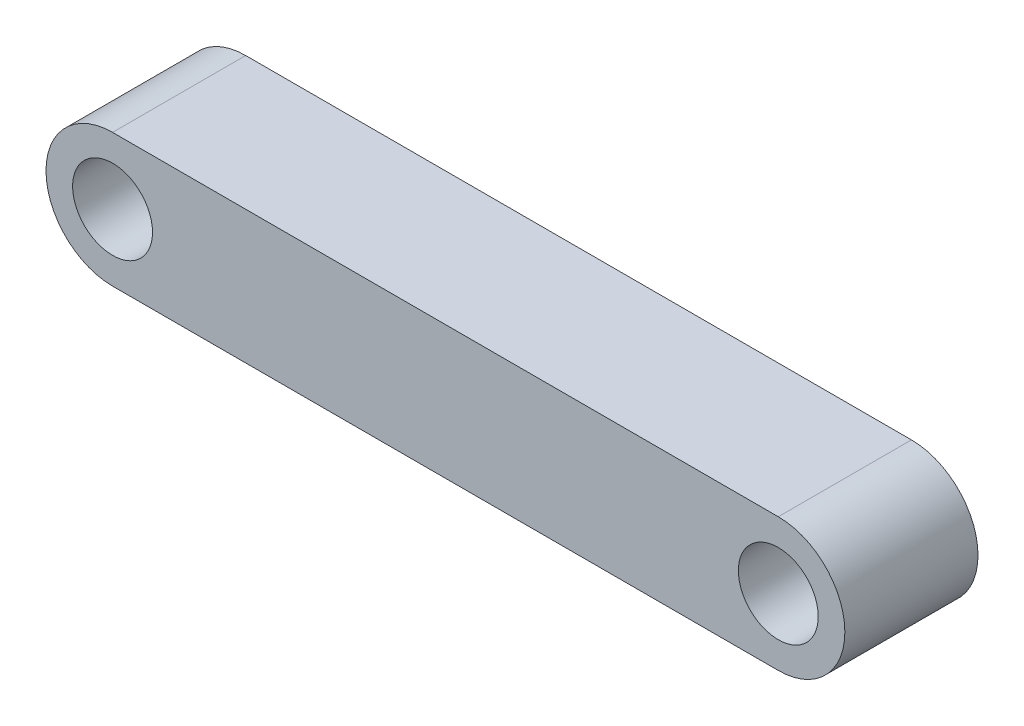
from build123d import *

# Parameters (mm, degrees)
BOSS_EXTRUDE1_DEPTH = 20
SKETCH2_R           = 6
CUT_EXTRUDE1_DEPTH  = 65.031242374


with BuildPart() as part:
    # Sketch1 → Boss-Extrude1 (new body)
    with BuildSketch(Plane.XY):
        with BuildLine():
            Line((50, -10), (-50, -10))
            ThreePointArc((-50, -10), (-60, 0), (-50, 10))
            Line((-50, 10), (50, 10))
            ThreePointArc((50, 10), (60, 0), (50, -10))
        make_face()
    extrude(amount=BOSS_EXTRUDE1_DEPTH)

    # Sketch2 → Cut-Extrude1 (cut, through all)
    with BuildSketch(Plane.XY.offset(20)):
        with Locations((-50, 0)):
            Circle(SKETCH2_R)
        with Locations((50, 0)):
            Circle(SKETCH2_R)
    extrude(amount=-CUT_EXTRUDE1_DEPTH, mode=Mode.SUBTRACT)


solid = part.part
